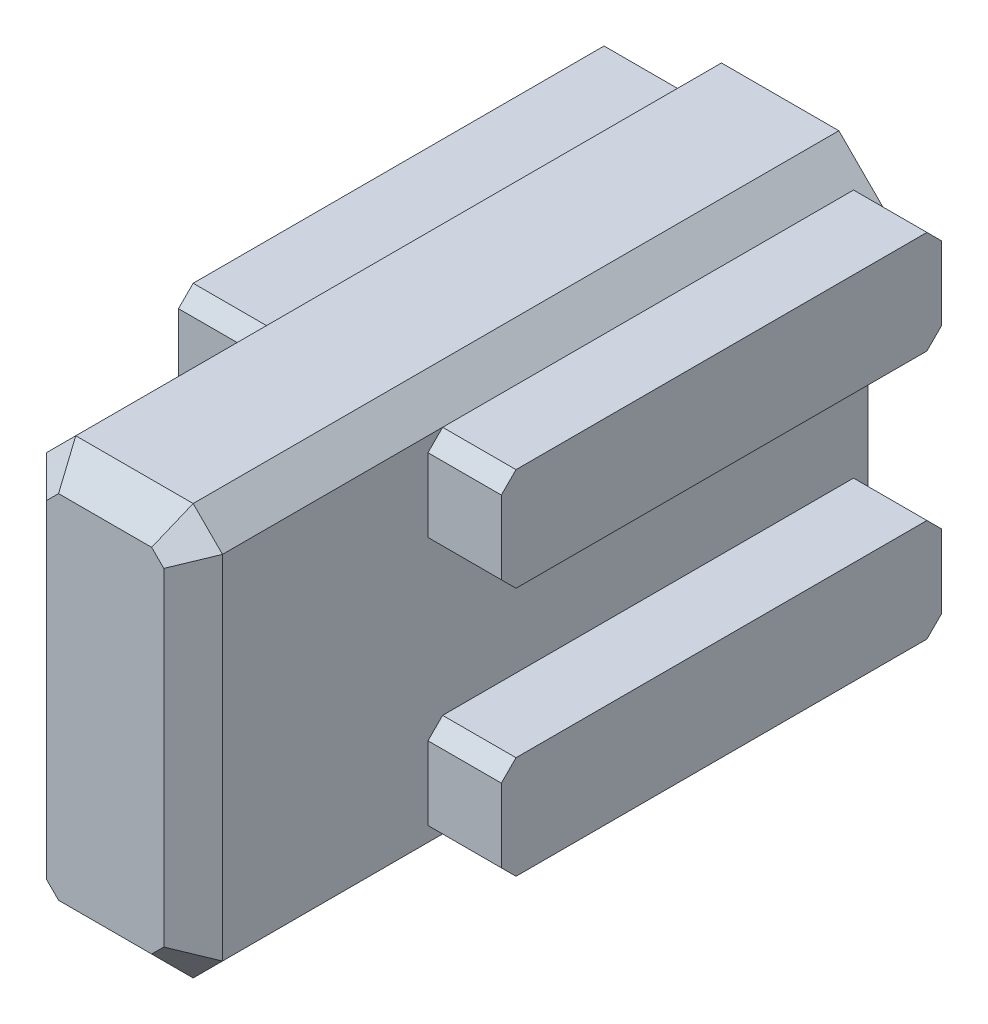
from build123d import *

# Parameters (mm, degrees)
SKETCH_1_W          = 6
SKETCH_1_H          = 14
EXTRUDE_1_DEPTH     = 23
CHAMFER_1_SIZE      = 1
SKETCH_2_W          = 2.5
SKETCH_2_H          = 3.5
EXTRUDE_2_DEPTH     = 15
CHAMFER_2_SIZE      = 0.5
CHAMFER_3_SIZE      = 1
SKETCH_3_R          = 2.35
CUT_EXTRUDE_1_DEPTH = 5


with BuildPart() as part:
    # 스케치1 → 보스-돌출1 (new body)
    with BuildSketch(Plane.XY):
        Rectangle(SKETCH_1_W, SKETCH_1_H)
    extrude(amount=EXTRUDE_1_DEPTH)

    # 모따기1
    chamfer_1_edges = [part.edges().sort_by_distance(p)[0] for p in [
        (3, -7, 11.5),
        (-3, -7, 11.5),
        (-3, 7, 11.5),
        (3, 7, 11.5),
    ]]
    chamfer(chamfer_1_edges, length=CHAMFER_1_SIZE)

    # 스케치2 → 보스-돌출2 (add)
    with BuildSketch(Plane.XY):
        with Locations((4.25, 4.25)):
            Rectangle(SKETCH_2_W, SKETCH_2_H)
        with Locations((4.25, -4.25)):
            Rectangle(SKETCH_2_W, SKETCH_2_H)
        with Locations((-4.25, -4.25)):
            Rectangle(SKETCH_2_W, SKETCH_2_H)
        with Locations((-4.25, 4.25)):
            Rectangle(SKETCH_2_W, SKETCH_2_H)
    extrude(amount=EXTRUDE_2_DEPTH)

    # 모따기2
    chamfer_2_edges = [part.edges().sort_by_distance(p)[0] for p in [
        (-4.25, -6, 15),
        (-4.25, -2.5, 15),
        (-4.25, 2.5, 15),
        (-4.25, 6, 15),
        (-4.25, 2.5, 0),
        (-4.25, 6, 0),
        (-4.25, -6, 0),
        (-4.25, -2.5, 0),
        (4.25, -2.5, 0),
        (4.25, -2.5, 15),
        (4.25, -6, 0),
        (4.25, -6, 15),
        (4.25, 2.5, 0),
        (4.25, 2.5, 15),
        (4.25, 6, 0),
        (4.25, 6, 15),
    ]]
    chamfer(chamfer_2_edges, length=CHAMFER_2_SIZE)

    # 모따기3
    chamfer_3_edges = [part.edges().sort_by_distance(p)[0] for p in [
        (0, -7, 23),
        (-3, 0, 23),
        (3, 0, 23),
        (0, 7, 23),
        (-2.5, 6.5, 23),
        (2.5, 6.5, 23),
        (2.5, -6.5, 23),
        (-2.5, -6.5, 23),
    ]]
    chamfer(chamfer_3_edges, length=CHAMFER_3_SIZE)

    # 스케치3 → 컷-돌출1 (cut)
    with BuildSketch(Plane(origin=(0, 0, 0), x_dir=(-1, 0, 0), z_dir=(0, 0, -1))):
        with Locations((0, 3.5)):
            Circle(SKETCH_3_R)
    extrude(amount=-CUT_EXTRUDE_1_DEPTH, mode=Mode.SUBTRACT)


solid = part.part
